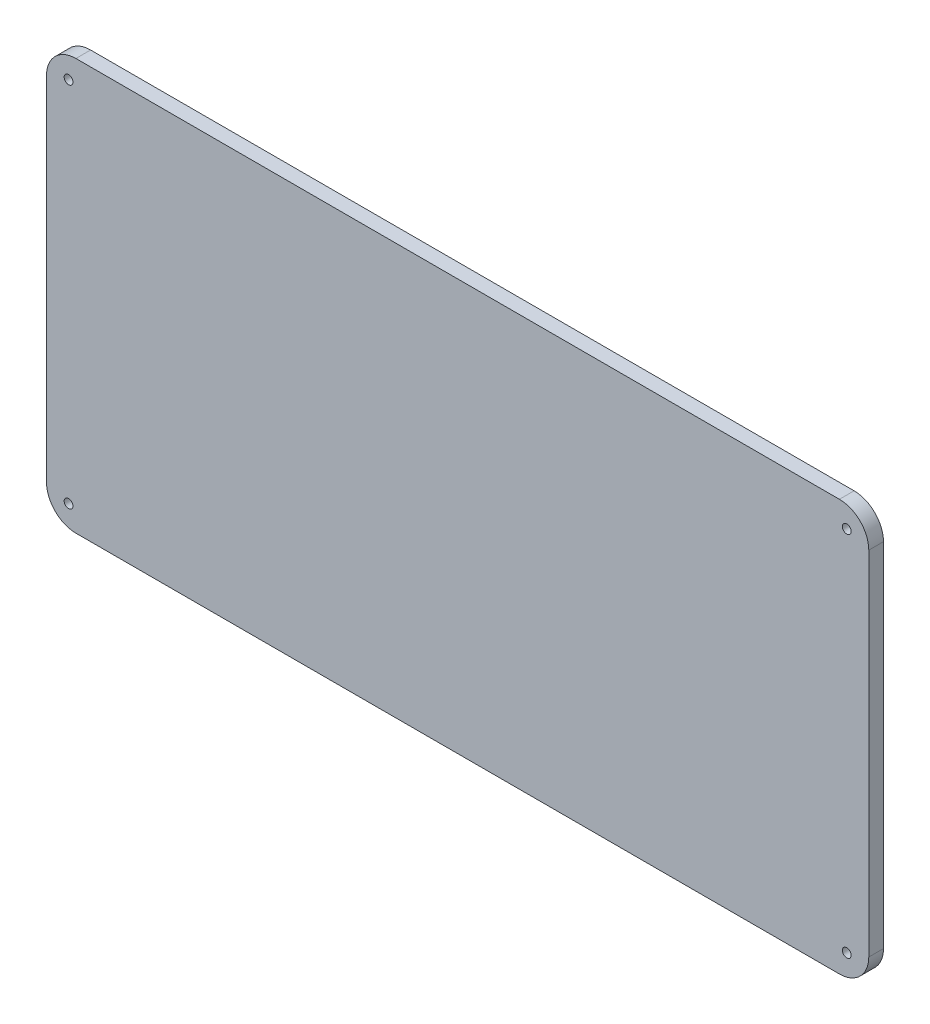
from build123d import *

# Parameters (mm, degrees)
SKETCH1_R           = 1.5
BOSS_EXTRUDE2_DEPTH = 3
BOSS_EXTRUDE3_DEPTH = 2
SKETCH3_R           = 1.5
CUT_EXTRUDE1_DEPTH  = 15.208
BOSS_EXTRUDE4_DEPTH = 5


with BuildPart() as part:
    # Sketch1 → Boss-Extrude2 (new body)
    with BuildSketch(Plane.XY):
        with BuildLine():
            Line((130, -70), (-130, -70))
            ThreePointArc((-130, -70), (-137.071067812, -67.071067812), (-140, -60))
            Line((-140, -60), (-140, 60))
            ThreePointArc((-140, 60), (-137.071067812, 67.071067812), (-130, 70))
            Line((-130, 70), (130, 70))
            ThreePointArc((130, 70), (137.071067812, 67.071067812), (140, 60))
            Line((140, 60), (140, -60))
            ThreePointArc((140, -60), (137.071067812, -67.071067812), (130, -70))
        make_face()
        with Locations((132.5, 62.5)):
            Circle(SKETCH1_R, mode=Mode.SUBTRACT)
        with Locations((-132.5, 62.5)):
            Circle(SKETCH1_R, mode=Mode.SUBTRACT)
        with Locations((-132.5, -62.5)):
            Circle(SKETCH1_R, mode=Mode.SUBTRACT)
        with Locations((132.5, -62.5)):
            Circle(SKETCH1_R, mode=Mode.SUBTRACT)
        with BuildLine():
            Line((130, 62), (130, 63))
            ThreePointArc((130, 63), (129.414213562, 64.414213562), (128, 65))
            Line((128, 65), (-128, 65))
            ThreePointArc((-128, 65), (-129.414213562, 64.414213562), (-130, 63))
            Line((-130, 63), (-130, 62))
            ThreePointArc((-130, 62), (-130.585786438, 60.585786438), (-132, 60))
            Line((-132, 60), (-133, 60))
            ThreePointArc((-133, 60), (-134.414213562, 59.414213562), (-135, 58))
            Line((-135, 58), (-135, -58))
            ThreePointArc((-135, -58), (-134.414213562, -59.414213562), (-133, -60))
            Line((-133, -60), (-132, -60))
            ThreePointArc((-132, -60), (-130.585786438, -60.585786438), (-130, -62))
            Line((-130, -62), (-130, -63))
            ThreePointArc((-130, -63), (-129.414213562, -64.414213562), (-128, -65))
            Line((-128, -65), (128, -65))
            ThreePointArc((128, -65), (129.414213562, -64.414213562), (130, -63))
            Line((130, -63), (130, -62))
            ThreePointArc((130, -62), (130.585786438, -60.585786438), (132, -60))
            Line((132, -60), (133, -60))
            ThreePointArc((133, -60), (134.414213562, -59.414213562), (135, -58))
            Line((135, -58), (135, 58))
            ThreePointArc((135, 58), (134.414213562, 59.414213562), (133, 60))
            Line((133, 60), (132, 60))
            ThreePointArc((132, 60), (130.585786438, 60.585786438), (130, 62))
        make_face(mode=Mode.SUBTRACT)
    extrude(amount=BOSS_EXTRUDE2_DEPTH)

    # Sketch2 → Boss-Extrude3 (add)
    with BuildSketch(Plane.XY.offset(3)):
        with BuildLine():
            Line((-130, -70), (130, -70))
            ThreePointArc((130, -70), (137.071067812, -67.071067812), (140, -60))
            Line((140, -60), (140, 60))
            ThreePointArc((140, 60), (137.071067812, 67.071067812), (130, 70))
            Line((130, 70), (-130, 70))
            ThreePointArc((-130, 70), (-137.071067812, 67.071067812), (-140, 60))
            Line((-140, 60), (-140, -60))
            ThreePointArc((-140, -60), (-137.071067812, -67.071067812), (-130, -70))
        make_face()
    extrude(amount=BOSS_EXTRUDE3_DEPTH)

    # Sketch3 → Cut-Extrude1 (cut)
    with BuildSketch(Plane(origin=(0, 0, 0), x_dir=(-1, 0, 0), z_dir=(0, 0, -1))):
        with Locations(Location((-132.5, -62.5, 0), (0, 0, 180))):
            Circle(SKETCH3_R)
        with Locations(Location((-132.5, 62.5, 0), (0, 0, 180))):
            Circle(SKETCH3_R)
        with Locations(Location((132.5, -62.5, 0), (0, 0, 180))):
            Circle(SKETCH3_R)
        with Locations(Location((132.5, 62.5, 0), (0, 0, 180))):
            Circle(SKETCH3_R)
    extrude(amount=-CUT_EXTRUDE1_DEPTH, mode=Mode.SUBTRACT)

    # Sketch4 → Boss-Extrude4 (add)
    with BuildSketch(Plane(origin=(0, 0, 3), x_dir=(-1, 0, 0), z_dir=(0, 0, -1))):
        with BuildLine():
            Line((129, 62), (129, 63))
            ThreePointArc((129, 63), (128.707106781, 63.707106781), (128, 64))
            Line((128, 64), (-128, 64))
            ThreePointArc((-128, 64), (-128.707106781, 63.707106781), (-129, 63))
            Line((-129, 63), (-129, 62))
            ThreePointArc((-129, 62), (-129.878679656, 59.878679656), (-132, 59))
            Line((-132, 59), (-133, 59))
            ThreePointArc((-133, 59), (-133.707106781, 58.707106781), (-134, 58))
            Line((-134, 58), (-134, -58))
            ThreePointArc((-134, -58), (-133.707106781, -58.707106781), (-133, -59))
            Line((-133, -59), (-132, -59))
            ThreePointArc((-132, -59), (-129.878679656, -59.878679656), (-129, -62))
            Line((-129, -62), (-129, -63))
            ThreePointArc((-129, -63), (-128.707106781, -63.707106781), (-128, -64))
            Line((-128, -64), (128, -64))
            ThreePointArc((128, -64), (128.707106781, -63.707106781), (129, -63))
            Line((129, -63), (129, -62))
            ThreePointArc((129, -62), (129.878679656, -59.878679656), (132, -59))
            Line((132, -59), (133, -59))
            ThreePointArc((133, -59), (133.707106781, -58.707106781), (134, -58))
            Line((134, -58), (134, 58))
            ThreePointArc((134, 58), (133.707106781, 58.707106781), (133, 59))
            Line((133, 59), (132, 59))
            ThreePointArc((132, 59), (129.878679656, 59.878679656), (129, 62))
        make_face()
        with BuildLine():
            Line((127, 62), (-127, 62))
            ThreePointArc((-127, 62), (-128.464466094, 58.464466094), (-132, 57))
            Line((-132, 57), (-132, -57))
            ThreePointArc((-132, -57), (-128.464466094, -58.464466094), (-127, -62))
            Line((-127, -62), (127, -62))
            ThreePointArc((127, -62), (128.464466094, -58.464466094), (132, -57))
            Line((132, -57), (132, 57))
            ThreePointArc((132, 57), (128.464466094, 58.464466094), (127, 62))
        make_face(mode=Mode.SUBTRACT)
    extrude(amount=BOSS_EXTRUDE4_DEPTH)


solid = part.part
